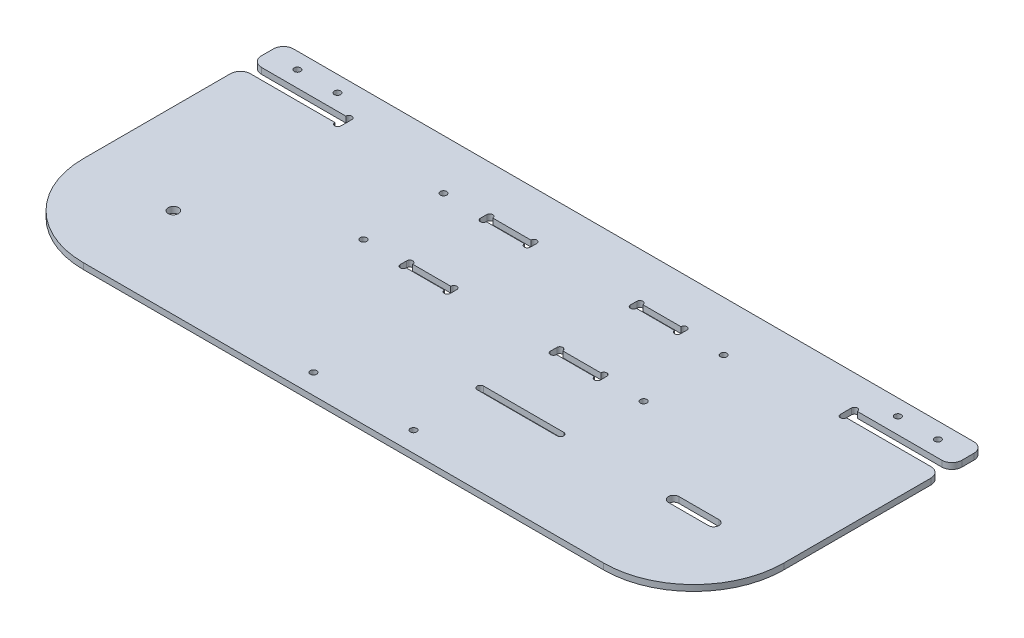
from build123d import *

# Parameters (mm, degrees)
SKETCH1_R           = 2.6
BOSS_EXTRUDE1_DEPTH = 3
SKETCH2_W           = 3
SKETCH2_H           = 3.2
SKETCH2_W_2         = 19
SKETCH2_R           = 1.6
CUT_EXTRUDE1_DEPTH  = 10
FILLET1_R           = 5
SKETCH3_R           = 1.6
CUT_EXTRUDE2_DEPTH  = 321.989096388
SKETCH4_W           = 47.2
SKETCH4_H           = 5.5
SKETCH4_W_2         = 3
CUT_EXTRUDE3_DEPTH  = 321.989096388
FILLET2_R           = 5


with BuildPart() as part:
    # Sketch1 → Boss-Extrude1 (new body)
    # profile 1 of 2: a face of its own
    with BuildSketch(Plane(origin=(0, 0, 0), x_dir=(1, 0, 0), z_dir=(0, 1, 0))):
        with BuildLine():
            Line((0, -45), (260, -45))
            ThreePointArc((260, -45), (305, 0), (260, 45))
            Line((260, 45), (0, 45))
            ThreePointArc((0, 45), (-45, 0), (0, -45))
        make_face()
        with Locations(Location((0, 0, 0), (0, 0, 270))):
            Circle(SKETCH1_R, mode=Mode.SUBTRACT)
        with BuildLine():
            ThreePointArc((250, 2.6), (247.4, 0), (250, -2.6))
            Line((250, -2.6), (270, -2.6))
            ThreePointArc((270, -2.6), (272.6, 0), (270, 2.6))
            Line((270, 2.6), (250, 2.6))
        make_face(mode=Mode.SUBTRACT)
    # profile 2 of 2: a face of its own
    with BuildSketch(Plane(origin=(0, 0, 0), x_dir=(1, 0, 0), z_dir=(0, 1, 0))):
        with BuildLine():
            ThreePointArc((-45, 0), (-31.819805153, 31.819805153), (0, 45))
            Line((0, 45), (260, 45))
            ThreePointArc((260, 45), (291.819805153, 31.819805153), (305, 0))
            Line((305, 0), (305, 100))
            Line((305, 100), (-45, 100))
            Line((-45, 100), (-45, 0))
        make_face()
    extrude(amount=BOSS_EXTRUDE1_DEPTH)

    # Sketch2 → Cut-Extrude1 (cut)
    with BuildSketch(Plane.XZ):
        with Locations((81.5, -35)):
            Rectangle(SKETCH2_W, SKETCH2_H)
        with BuildLine():
            Line((80, -33.4), (83, -33.4))
            ThreePointArc((83, -33.4), (81.5, -31.9), (80, -33.4))
        make_face()
        with BuildLine():
            ThreePointArc((80, -36.6), (81.5, -38.1), (83, -36.6))
            Line((83, -36.6), (80, -36.6))
        make_face()
        with Locations((92.5, -35)):
            Rectangle(SKETCH2_W_2, SKETCH2_H)
        with BuildLine():
            ThreePointArc((105, -33.4), (103.5, -31.9), (102, -33.4))
            Line((102, -33.4), (105, -33.4))
        make_face()
        with Locations((103.5, -35)):
            Rectangle(SKETCH2_W, SKETCH2_H)
        with BuildLine():
            Line((105, -36.6), (102, -36.6))
            ThreePointArc((102, -36.6), (103.5, -38.1), (105, -36.6))
        make_face()
        with BuildLine():
            ThreePointArc((83, -73.4), (81.5, -71.9), (80, -73.4))
            Line((80, -73.4), (83, -73.4))
        make_face()
        with Locations((81.5, -75)):
            Rectangle(SKETCH2_W, SKETCH2_H)
        with Locations((92.5, -75)):
            Rectangle(SKETCH2_W_2, SKETCH2_H)
        with BuildLine():
            Line((83, -76.6), (80, -76.6))
            ThreePointArc((80, -76.6), (81.5, -78.1), (83, -76.6))
        make_face()
        with BuildLine():
            ThreePointArc((105, -73.4), (103.5, -71.9), (102, -73.4))
            Line((102, -73.4), (105, -73.4))
        make_face()
        with Locations((103.5, -75)):
            Rectangle(SKETCH2_W, SKETCH2_H)
        with BuildLine():
            Line((105, -76.6), (102, -76.6))
            ThreePointArc((102, -76.6), (103.5, -78.1), (105, -76.6))
        make_face()
        with BuildLine():
            Line((155, -33.4), (158, -33.4))
            ThreePointArc((158, -33.4), (156.5, -31.9), (155, -33.4))
        make_face()
        with Locations((156.5, -35)):
            Rectangle(SKETCH2_W, SKETCH2_H)
        with BuildLine():
            ThreePointArc((155, -36.6), (156.5, -38.1), (158, -36.6))
            Line((158, -36.6), (155, -36.6))
        make_face()
        with Locations((167.5, -35)):
            Rectangle(SKETCH2_W_2, SKETCH2_H)
        with BuildLine():
            Line((177, -33.4), (180, -33.4))
            ThreePointArc((180, -33.4), (178.5, -31.9), (177, -33.4))
        make_face()
        with Locations((178.5, -35)):
            Rectangle(SKETCH2_W, SKETCH2_H)
        with BuildLine():
            ThreePointArc((177, -36.6), (178.5, -38.1), (180, -36.6))
            Line((180, -36.6), (177, -36.6))
        make_face()
        with BuildLine():
            ThreePointArc((158, -73.4), (156.5, -71.9), (155, -73.4))
            Line((155, -73.4), (158, -73.4))
        make_face()
        with Locations((156.5, -75)):
            Rectangle(SKETCH2_W, SKETCH2_H)
        with BuildLine():
            Line((158, -76.6), (155, -76.6))
            ThreePointArc((155, -76.6), (156.5, -78.1), (158, -76.6))
        make_face()
        with Locations((167.5, -75)):
            Rectangle(SKETCH2_W_2, SKETCH2_H)
        with BuildLine():
            ThreePointArc((180, -73.4), (178.5, -71.9), (177, -73.4))
            Line((177, -73.4), (180, -73.4))
        make_face()
        with Locations((178.5, -75)):
            Rectangle(SKETCH2_W, SKETCH2_H)
        with BuildLine():
            Line((180, -76.6), (177, -76.6))
            ThreePointArc((177, -76.6), (178.5, -78.1), (180, -76.6))
        make_face()
        with Locations(Location((200, -75, 0), (0, 0, 270))):
            Circle(SKETCH2_R)
        with Locations(Location((290, -92, 0), (0, 0, 270))):
            Circle(SKETCH2_R)
        with Locations(Location((270, -92, 0), (0, 0, 270))):
            Circle(SKETCH2_R)
        with Locations(Location((60, -35, 0), (0, 0, 90))):
            Circle(SKETCH2_R)
        with Locations(Location((60, -75, 0), (0, 0, 270))):
            Circle(SKETCH2_R)
        with Locations(Location((-10, -92, 0), (0, 0, 270))):
            Circle(SKETCH2_R)
        with Locations(Location((-30, -92, 0), (0, 0, 270))):
            Circle(SKETCH2_R)
        with Locations(Location((200, -35, 0), (0, 0, 270))):
            Circle(SKETCH2_R)
    extrude(amount=-CUT_EXTRUDE1_DEPTH, mode=Mode.SUBTRACT)

    # Fillet1
    fillet1_edges = [part.edges().sort_by_distance(p)[0] for p in [
        (-45, 1.5, -100),
        (305, 1.5, -100),
    ]]
    fillet(fillet1_edges, radius=FILLET1_R)

    # Sketch3 → Cut-Extrude2 (cut, through all)
    with BuildSketch(Plane.XZ):
        with Locations(Location((105, 35, 0), (0, 0, 270))):
            Circle(SKETCH3_R)
        with Locations(Location((155, 35, 0), (0, 0, 270))):
            Circle(SKETCH3_R)
        with BuildLine():
            Line((193.4, -1.6), (153.4, -1.6))
            ThreePointArc((153.4, -1.6), (151.8, 0), (153.4, 1.6))
            Line((153.4, 1.6), (193.4, 1.6))
            ThreePointArc((193.4, 1.6), (195, 0), (193.4, -1.6))
        make_face()
    extrude(amount=-CUT_EXTRUDE2_DEPTH, mode=Mode.SUBTRACT)

    # Sketch4 → Cut-Extrude3 (cut, through all)
    with BuildSketch(Plane(origin=(0, 3, 0), x_dir=(1, 0, 0), z_dir=(0, 1, 0))):
        with Locations((-21.4, 81.25)):
            Rectangle(SKETCH4_W, SKETCH4_H)
        with Locations((3.7, 81.25)):
            Rectangle(SKETCH4_W_2, SKETCH4_H)
        with BuildLine():
            ThreePointArc((5.2, 84), (3.7, 85.5), (2.2, 84))
            Line((2.2, 84), (5.2, 84))
        make_face()
        with BuildLine():
            Line((5.2, 78.5), (2.2, 78.5))
            ThreePointArc((2.2, 78.5), (3.7, 77), (5.2, 78.5))
        make_face()
        with BuildLine():
            ThreePointArc((257.8, 84), (256.3, 85.5), (254.8, 84))
            Line((254.8, 84), (257.8, 84))
        make_face()
        with Locations((256.3, 81.25)):
            Rectangle(SKETCH4_W_2, SKETCH4_H)
        with BuildLine():
            Line((257.8, 78.5), (254.8, 78.5))
            ThreePointArc((254.8, 78.5), (256.3, 77), (257.8, 78.5))
        make_face()
        with Locations((281.4, 81.25)):
            Rectangle(SKETCH4_W, SKETCH4_H)
    extrude(amount=-CUT_EXTRUDE3_DEPTH, mode=Mode.SUBTRACT)

    # Fillet2
    fillet2_edges = [part.edges().sort_by_distance(p)[0] for p in [
        (-45, 1.5, -78.5),
        (-45, 1.5, -84),
        (305, 1.5, -84),
        (305, 1.5, -78.5),
    ]]
    fillet(fillet2_edges, radius=FILLET2_R)


solid = part.part
